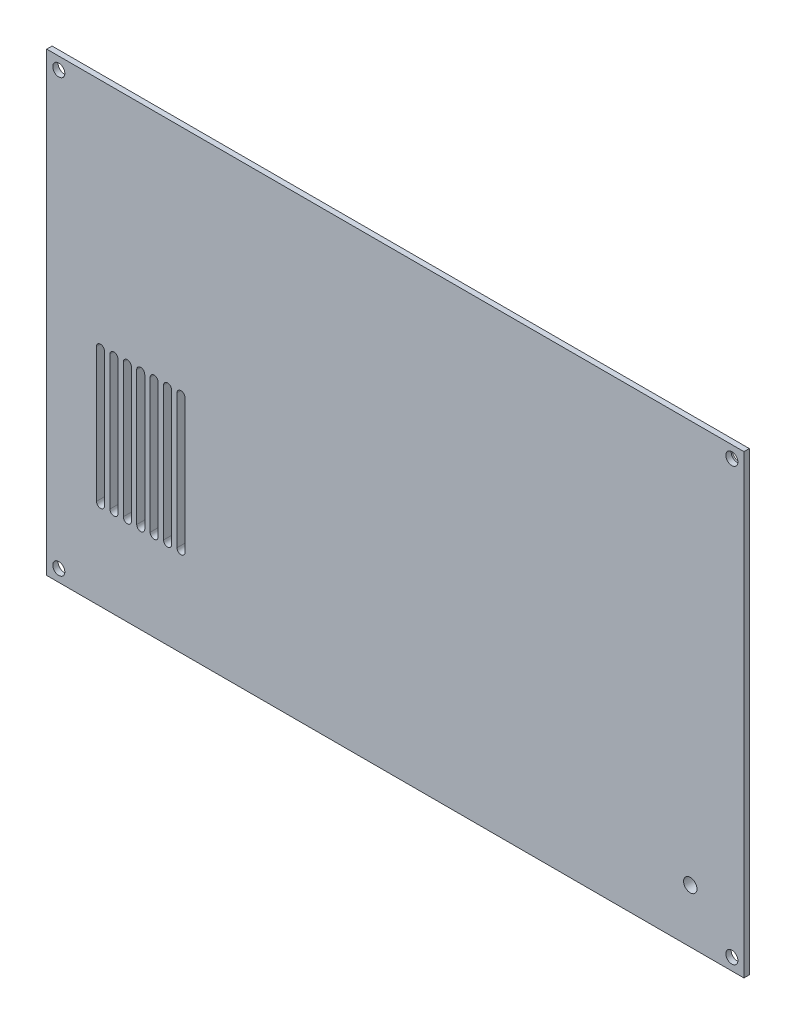
from build123d import *

# Parameters (mm, degrees)
SKETCH1_W           = 260
SKETCH1_H           = 170
BOSS_EXTRUDE1_DEPTH = 2
BOSS_EXTRUDE2_DEPTH = 3
CUT_EXTRUDE1_DEPTH  = 156.402702679
SKETCH4_R           = 2.5
CUT_EXTRUDE2_DEPTH  = 156.402702679
CUT_EXTRUDE3_REACH  = 157.403
SKETCH6_R           = 2.25


with BuildPart() as part:
    # Sketch1 → Boss-Extrude1 (new body)
    with BuildSketch(Plane.XY):
        Rectangle(SKETCH1_W, SKETCH1_H)
    extrude(amount=BOSS_EXTRUDE1_DEPTH)

    # Sketch2 → Boss-Extrude2 (add)
    with BuildSketch(Plane(origin=(0, 0, 0), x_dir=(-1, 0, 0), z_dir=(0, 0, -1))):
        with BuildLine():
            Line((-120.492, 81.492), (120.492, 81.492))
            Line((120.492, 81.492), (120.492, 79))
            ThreePointArc((120.492, 79), (121.519469412, 76.519469412), (124, 75.492))
            Line((124, 75.492), (126.492, 75.492))
            Line((126.492, 75.492), (126.492, -75.492))
            Line((126.492, -75.492), (124, -75.492))
            ThreePointArc((124, -75.492), (121.519469412, -76.519469412), (120.492, -79))
            Line((120.492, -79), (120.492, -81.492))
            Line((120.492, -81.492), (-120.492, -81.492))
            Line((-120.492, -81.492), (-120.492, -79))
            ThreePointArc((-120.492, -79), (-121.519469412, -76.519469412), (-124, -75.492))
            Line((-124, -75.492), (-126.492, -75.492))
            Line((-126.492, -75.492), (-126.492, 75.492))
            Line((-126.492, 75.492), (-124, 75.492))
            ThreePointArc((-124, 75.492), (-121.519469412, 76.519469412), (-120.492, 79))
            Line((-120.492, 79), (-120.492, 81.492))
        make_face()
    extrude(amount=BOSS_EXTRUDE2_DEPTH)

    # Sketch3 → Cut-Extrude1 (cut, through all)
    with BuildSketch(Plane.XY.offset(2)):
        with BuildLine():
            Line((-108.441183291, -1.769742849), (-108.441183291, -51.769742849))
            ThreePointArc((-108.441183291, -51.769742849), (-109.941183291, -53.269742849), (-111.441183291, -51.769742849))
            Line((-111.441183291, -51.769742849), (-111.441183291, -1.769742849))
            ThreePointArc((-111.441183291, -1.769742849), (-109.941183291, -0.269742849), (-108.441183291, -1.769742849))
        make_face()
        with BuildLine():
            Line((-103.441183291, -1.769742849), (-103.441183291, -51.769742849))
            ThreePointArc((-103.441183291, -51.769742849), (-104.941183291, -53.269742849), (-106.441183291, -51.769742849))
            Line((-106.441183291, -51.769742849), (-106.441183291, -1.769742849))
            ThreePointArc((-106.441183291, -1.769742849), (-104.941183291, -0.269742849), (-103.441183291, -1.769742849))
        make_face()
        with BuildLine():
            Line((-98.441183291, -1.769742849), (-98.441183291, -51.769742849))
            ThreePointArc((-98.441183291, -51.769742849), (-99.941183291, -53.269742849), (-101.441183291, -51.769742849))
            Line((-101.441183291, -51.769742849), (-101.441183291, -1.769742849))
            ThreePointArc((-101.441183291, -1.769742849), (-99.941183291, -0.269742849), (-98.441183291, -1.769742849))
        make_face()
        with BuildLine():
            Line((-93.441183291, -1.769742849), (-93.441183291, -51.769742849))
            ThreePointArc((-93.441183291, -51.769742849), (-94.941183291, -53.269742849), (-96.441183291, -51.769742849))
            Line((-96.441183291, -51.769742849), (-96.441183291, -1.769742849))
            ThreePointArc((-96.441183291, -1.769742849), (-94.941183291, -0.269742849), (-93.441183291, -1.769742849))
        make_face()
        with BuildLine():
            Line((-88.441183291, -1.769742849), (-88.441183291, -51.769742849))
            ThreePointArc((-88.441183291, -51.769742849), (-89.941183291, -53.269742849), (-91.441183291, -51.769742849))
            Line((-91.441183291, -51.769742849), (-91.441183291, -1.769742849))
            ThreePointArc((-91.441183291, -1.769742849), (-89.941183291, -0.269742849), (-88.441183291, -1.769742849))
        make_face()
        with BuildLine():
            Line((-83.441183291, -1.769742849), (-83.441183291, -51.769742849))
            ThreePointArc((-83.441183291, -51.769742849), (-84.941183291, -53.269742849), (-86.441183291, -51.769742849))
            Line((-86.441183291, -51.769742849), (-86.441183291, -1.769742849))
            ThreePointArc((-86.441183291, -1.769742849), (-84.941183291, -0.269742849), (-83.441183291, -1.769742849))
        make_face()
        with BuildLine():
            Line((-78.441183291, -1.769742849), (-78.441183291, -51.769742849))
            ThreePointArc((-78.441183291, -51.769742849), (-79.941183291, -53.269742849), (-81.441183291, -51.769742849))
            Line((-81.441183291, -51.769742849), (-81.441183291, -1.769742849))
            ThreePointArc((-81.441183291, -1.769742849), (-79.941183291, -0.269742849), (-78.441183291, -1.769742849))
        make_face()
    extrude(amount=-CUT_EXTRUDE1_DEPTH, mode=Mode.SUBTRACT)

    # Sketch4 → Cut-Extrude2 (cut, through all)
    with BuildSketch(Plane.XY.offset(2)):
        with Locations((110, -65)):
            Circle(SKETCH4_R)
    extrude(amount=-CUT_EXTRUDE2_DEPTH, mode=Mode.SUBTRACT)

    # Sketch6 → Cut-Extrude3 (cut, up to next)
    with BuildSketch(Plane.XY.offset(2), mode=Mode.PRIVATE) as cut_extrude3_sk1:
        with Locations((-125.5, -80.5)):
            Circle(SKETCH6_R)
    cut_extrude3_tool1 = extrude(cut_extrude3_sk1.sketch, amount=-CUT_EXTRUDE3_REACH, mode=Mode.PRIVATE) & part.part
    # Sketch6 → Cut-Extrude3 (cut, up to next)
    with BuildSketch(Plane.XY.offset(2), mode=Mode.PRIVATE) as cut_extrude3_sk2:
        with Locations((-125.5, 80.5)):
            Circle(SKETCH6_R)
    cut_extrude3_tool2 = extrude(cut_extrude3_sk2.sketch, amount=-CUT_EXTRUDE3_REACH, mode=Mode.PRIVATE) & part.part
    # Sketch6 → Cut-Extrude3 (cut, up to next)
    with BuildSketch(Plane.XY.offset(2), mode=Mode.PRIVATE) as cut_extrude3_sk3:
        with Locations((125.5, 80.5)):
            Circle(SKETCH6_R)
    cut_extrude3_tool3 = extrude(cut_extrude3_sk3.sketch, amount=-CUT_EXTRUDE3_REACH, mode=Mode.PRIVATE) & part.part
    # Sketch6 → Cut-Extrude3 (cut, up to next)
    with BuildSketch(Plane.XY.offset(2), mode=Mode.PRIVATE) as cut_extrude3_sk4:
        with Locations((125.5, -80.5)):
            Circle(SKETCH6_R)
    cut_extrude3_tool4 = extrude(cut_extrude3_sk4.sketch, amount=-CUT_EXTRUDE3_REACH, mode=Mode.PRIVATE) & part.part
    add(cut_extrude3_tool1.solids().sort_by_distance((-125.5, -80.5, 2))[0], mode=Mode.SUBTRACT)
    add(cut_extrude3_tool2.solids().sort_by_distance((-125.5, 80.5, 2))[0], mode=Mode.SUBTRACT)
    add(cut_extrude3_tool3.solids().sort_by_distance((125.5, 80.5, 2))[0], mode=Mode.SUBTRACT)
    add(cut_extrude3_tool4.solids().sort_by_distance((125.5, -80.5, 2))[0], mode=Mode.SUBTRACT)


solid = part.part
